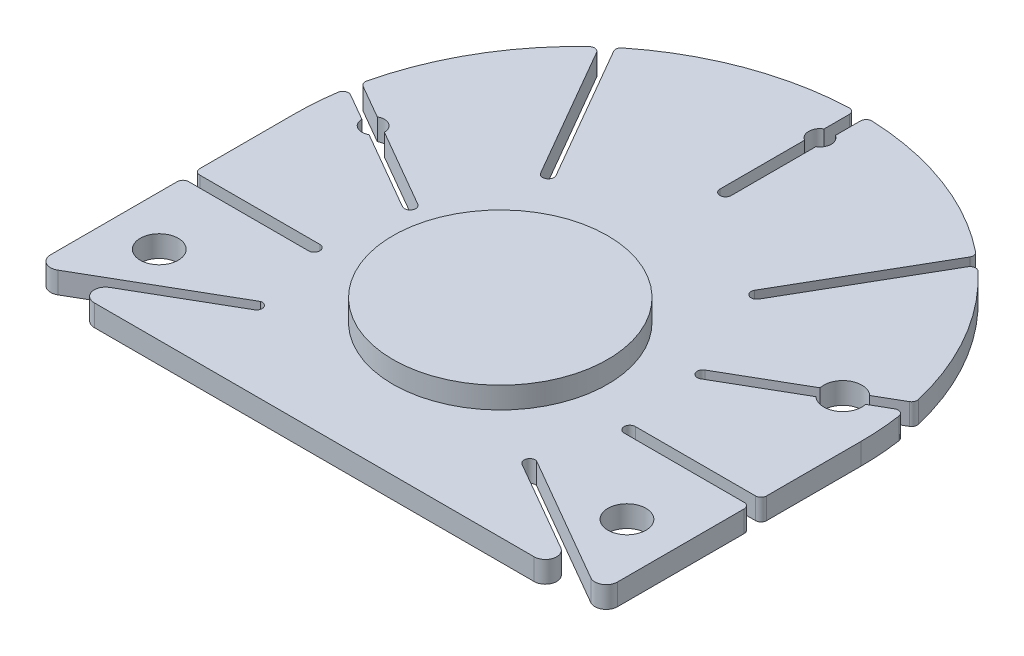
from build123d import *

# Parameters (mm, degrees)
SKETCH2_R                   = 2
BOSS_EXTRUDE1_DEPTH         = 3.81
SKETCH3_R                   = 19.05
BOSS_EXTRUDE2_DEPTH         = 3.81
F_1_4_CLEARANCE_HOLE1_D     = 6.7564
F_1_4_CLEARANCE_HOLE1_DEPTH = 3.81


with BuildPart() as part:
    # Sketch2 → Boss-Extrude1 (new body)
    with BuildSketch(Plane(origin=(0, 0, 0), x_dir=(1, 0, 0), z_dir=(0, 1, 0))):
        with BuildLine():
            Line((40.724728738, 1.878024889), (26.480762114, -6.345733076))
            ThreePointArc((26.480762114, -6.345733076), (25.11473671, -5.979707672), (25.480762114, -4.613682268))
            Line((25.480762114, -4.613682268), (39.724728738, 3.610075697))
            ThreePointArc((39.724728738, 3.610075697), (40.724728738, 5.342126504), (42.724728738, 5.342126504))
            Line((42.724728738, 5.342126504), (48.484388044, 8.667467356))
            ThreePointArc((48.484388044, 8.667467356), (48.902372172, 9.136875637), (48.957702204, 9.762969441))
            ThreePointArc((48.957702204, 9.762969441), (43.570719337, 23.353585317), (34.503184828, 34.821115225))
            ThreePointArc((34.503184828, 34.821115225), (33.67210529, 35.082877041), (32.951211415, 34.593464671))
            Line((32.951211415, 34.593464671), (19.366025404, 11.063232268))
            ThreePointArc((19.366025404, 11.063232268), (18, 10.697206864), (17.633974596, 12.063232268))
            Line((17.633974596, 12.063232268), (31.605824937, 36.263186935))
            ThreePointArc((31.605824937, 36.263186935), (31.722370232, 36.949076207), (31.363324879, 37.544990071))
            ThreePointArc((31.363324879, 37.544990071), (17.573916059, 45.350404511), (2.040567951, 48.478884454))
            ThreePointArc((2.040567951, 48.478884454), (1.307384649, 48.201014802), (1, 47.479707672))
            Line((1, 47.479707672), (1, 43.010935261))
            ThreePointArc((1, 43.010935261), (2, 41.278884454), (1, 39.546833646))
            Line((1, 39.546833646), (1, 24.520292328))
            ThreePointArc((1, 24.520292328), (0, 23.520292328), (-1, 24.520292328))
            Line((-1, 24.520292328), (-1, 39.546833646))
            ThreePointArc((-1, 39.546833646), (-2, 41.278884454), (-1, 43.010935261))
            Line((-1, 43.010935261), (-1, 47.479707672))
            ThreePointArc((-1, 47.479707672), (-1.307384649, 48.201014802), (-2.040567951, 48.478884454))
            ThreePointArc((-2.040567951, 48.478884454), (-17.573916059, 45.350404511), (-31.363324879, 37.544990071))
            ThreePointArc((-31.363324879, 37.544990071), (-31.722370232, 36.949076207), (-31.605824937, 36.263186935))
            Line((-31.605824937, 36.263186935), (-17.633974596, 12.063232268))
            ThreePointArc((-17.633974596, 12.063232268), (-18, 10.697206864), (-19.366025404, 11.063232268))
            Line((-19.366025404, 11.063232268), (-32.951211415, 34.593464671))
            ThreePointArc((-32.951211415, 34.593464671), (-33.67210529, 35.082877041), (-34.503184828, 34.821115225))
            ThreePointArc((-34.503184828, 34.821115225), (-43.570719337, 23.353585317), (-48.957702204, 9.762969441))
            ThreePointArc((-48.957702204, 9.762969441), (-48.902372172, 9.136875637), (-48.484388044, 8.667467356))
            Line((-48.484388044, 8.667467356), (-42.5, 5.212379307))
            ThreePointArc((-42.5, 5.212379307), (-40.5, 5.212379307), (-39.5, 3.4803285))
            Line((-39.5, 3.4803285), (-25.480762114, -4.613682268))
            ThreePointArc((-25.480762114, -4.613682268), (-25.11473671, -5.979707672), (-26.480762114, -6.345733076))
            Line((-26.480762114, -6.345733076), (-40.5, 1.748277692))
            ThreePointArc((-40.5, 1.748277692), (-42.5, 1.748277692), (-43.5, 3.4803285))
            Line((-43.5, 3.4803285), (-48.278351245, 6.239110877))
            ThreePointArc((-48.278351245, 6.239110877), (-49.214035452, 6.273185063), (-49.767770135, 5.518172556))
            ThreePointArc((-49.767770135, 5.518172556), (-50.16676608, 1.878923371), (-50.3, -1.779707672))
            Line((-50.3, -1.779707672), (-50.3, -18.479707672))
            ThreePointArc((-50.3, -18.479707672), (-50.007106781, -19.186814453), (-49.3, -19.479707672))
            Line((-49.3, -19.479707672), (-28, -19.479707672))
            ThreePointArc((-28, -19.479707672), (-27, -20.479707672), (-28, -21.479707672))
            Line((-28, -21.479707672), (-49.3, -21.479707672))
            ThreePointArc((-49.3, -21.479707672), (-50.007106781, -21.772600891), (-50.3, -22.479707672))
            Line((-50.3, -22.479707672), (-50.3, -44.954844537))
            ThreePointArc((-50.3, -44.954844537), (-49.3, -46.686895345), (-47.3, -46.686895345))
            Line((-47.3, -46.686895345), (-24.465777351, -33.503550752))
            ThreePointArc((-24.465777351, -33.503550752), (-23.31681977, -34.116970624), (-23.748711306, -35.345733076))
            Line((-23.748711306, -35.345733076), (-40.033320997, -44.747656864))
            ThreePointArc((-40.033320997, -44.747656864), (-40.965172649, -46.997345762), (-39.033320997, -48.479707672))
            Line((-39.033320997, -48.479707672), (39.033320997, -48.479707672))
            ThreePointArc((39.033320997, -48.479707672), (40.965172649, -46.997345762), (40.033320997, -44.747656864))
            Line((40.033320997, -44.747656864), (23.748711306, -35.345733076))
            ThreePointArc((23.748711306, -35.345733076), (23.31681977, -34.116970624), (24.465777351, -33.503550752))
            Line((24.465777351, -33.503550752), (47.3, -46.686895345))
            ThreePointArc((47.3, -46.686895345), (49.3, -46.686895345), (50.3, -44.954844537))
            Line((50.3, -44.954844537), (50.3, -22.479707672))
            ThreePointArc((50.3, -22.479707672), (50.007106781, -21.772600891), (49.3, -21.479707672))
            Line((49.3, -21.479707672), (28, -21.479707672))
            ThreePointArc((28, -21.479707672), (27, -20.479707672), (28, -19.479707672))
            Line((28, -19.479707672), (49.3, -19.479707672))
            ThreePointArc((49.3, -19.479707672), (50.007106781, -19.186814453), (50.3, -18.479707672))
            Line((50.3, -18.479707672), (50.3, -1.779707672))
            ThreePointArc((50.3, -1.779707672), (50.16676608, 1.878923371), (49.767770135, 5.518172556))
            ThreePointArc((49.767770135, 5.518172556), (49.214035452, 6.273185063), (48.278351245, 6.239110877))
            Line((48.278351245, 6.239110877), (43.724728738, 3.610075697))
            ThreePointArc((43.724728738, 3.610075697), (42.724728738, 1.878024889), (40.724728738, 1.878024889))
        make_face()
        with Locations(Location((-41.5, -34.479707672, 0), (0, 0, 90))):
            Circle(SKETCH2_R, mode=Mode.SUBTRACT)
        with Locations(Location((41.5, -34.479707672, 0), (0, 0, 90))):
            Circle(SKETCH2_R, mode=Mode.SUBTRACT)
    extrude(amount=BOSS_EXTRUDE1_DEPTH)

    # Sketch3 → Boss-Extrude2 (add)
    with BuildSketch(Plane(origin=(0, 3.81, 0), x_dir=(1, 0, 0), z_dir=(0, 1, 0))):
        with Locations(Location((0, -15.459707672, 0), (0, 0, 90))):
            Circle(SKETCH3_R)
    extrude(amount=BOSS_EXTRUDE2_DEPTH)

    # 1/4 Clearance Hole1
    with Locations(Plane(origin=(0, 3.81, 0), x_dir=(1, 0, 0), z_dir=(0, 1, 0))):
        with Locations((41.5, -34.479707672), (41.724728738, 3.610075697), (-41.5, -34.479707672)):
            Hole(F_1_4_CLEARANCE_HOLE1_D / 2, depth=F_1_4_CLEARANCE_HOLE1_DEPTH)


solid = part.part
